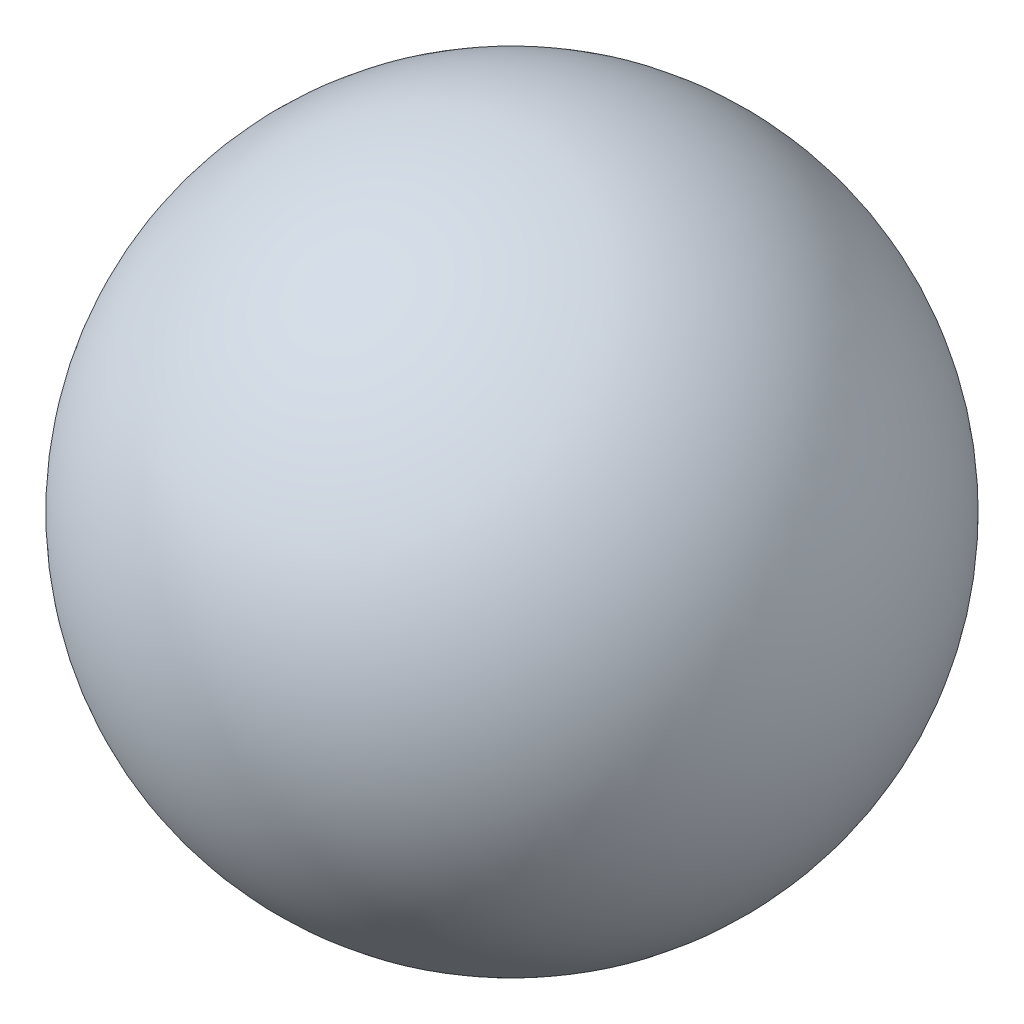
from build123d import *


with BuildPart() as part:
    # Sketch2 → Revolve2 (revolve)
    with BuildSketch(Plane.XY):
        with BuildLine():
            Line((0, 100), (0, -100))
            ThreePointArc((0, -100), (-100, 0), (0, 100))
        make_face()
    revolve(axis=Axis((0, -22, 0), (0, 1, 0)))


solid = part.part
